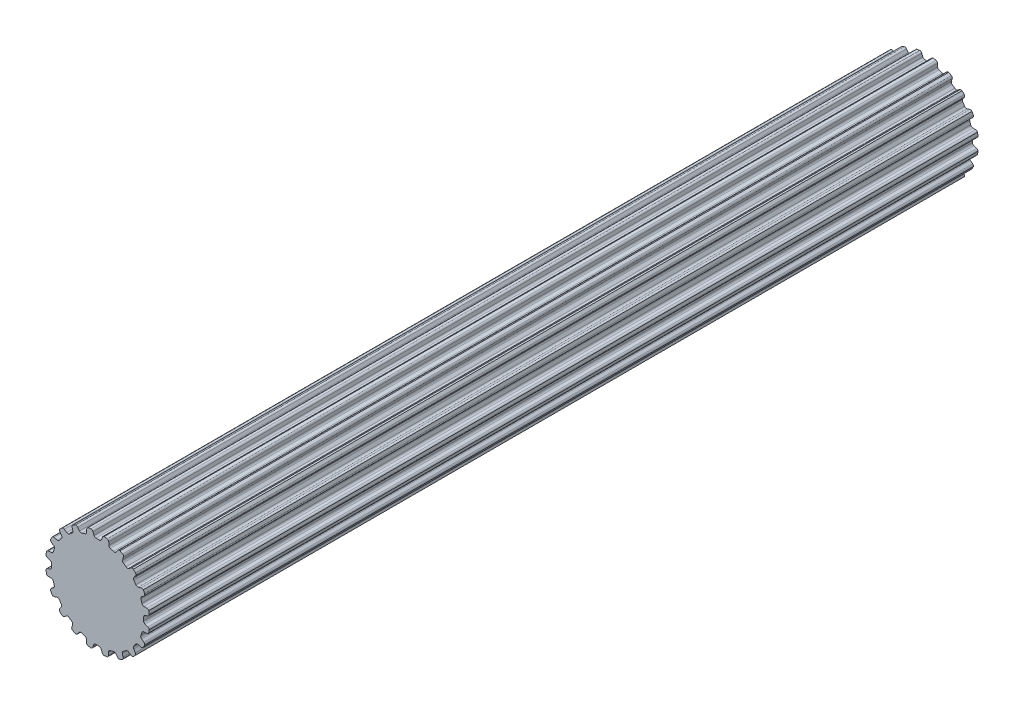
from build123d import *

# Parameters (mm, degrees)
BOSS_EXTRUDE1_DEPTH = 26.70556


with BuildPart() as part:
    # Sketch1 → Boss-Extrude1 (new, symmetric)
    with BuildSketch(Plane.XY):
        with BuildLine():
            Line((-0.106949245, 2.969874934), (0.106949245, 2.969874934))
            ThreePointArc((0.106949245, 2.969874934), (0.196343213, 2.986924176), (0.253739238, 3.057547504))
            Line((0.253739238, 3.057547504), (0.315888147, 3.237526941))
            ThreePointArc((0.315888147, 3.237526941), (0.359032156, 3.298322911), (0.4281449, 3.326269005))
            Line((0.4281449, 3.326269005), (0.620027588, 3.2937547))
            ThreePointArc((0.620027588, 3.2937547), (0.689621142, 3.24802576), (0.718272212, 3.169836791))
            Line((0.718272212, 3.169836791), (0.724389167, 2.979527391))
            ThreePointArc((0.724389167, 2.979527391), (0.750934762, 2.9040661), (0.816027049, 2.857568043))
            Line((0.816027049, 2.857568043), (1.019456602, 2.791469774))
            ThreePointArc((1.019456602, 2.791469774), (1.109743823, 2.780060312), (1.186154496, 2.829490741))
            Line((1.186154496, 2.829490741), (1.300878326, 2.981456288))
            ThreePointArc((1.300878326, 2.981456288), (1.360697704, 3.02594446), (1.435063648, 3.031165762))
            Line((1.435063648, 3.031165762), (1.607507455, 2.940947809))
            ThreePointArc((1.607507455, 2.940947809), (1.659563839, 2.875951412), (1.662650905, 2.792735615))
            Line((1.662650905, 2.792735615), (1.609659636, 2.609850378))
            ThreePointArc((1.609659636, 2.609850378), (1.611587176, 2.529879385), (1.659124931, 2.465542482))
            Line((1.659124931, 2.465542482), (1.832172444, 2.339816104))
            ThreePointArc((1.832172444, 2.339816104), (1.914514976, 2.301064775), (2.002460687, 2.32446371))
            Line((2.002460687, 2.32446371), (2.158529469, 2.433539921))
            ThreePointArc((2.158529469, 2.433539921), (2.229168681, 2.457365482), (2.301508367, 2.439350895))
            Line((2.301508367, 2.439350895), (2.437633293, 2.300260456))
            ThreePointArc((2.437633293, 2.300260456), (2.467056864, 2.222358901), (2.444277744, 2.14226202))
            Line((2.444277744, 2.14226202), (2.337365406, 1.984703026))
            ThreePointArc((2.337365406, 1.984703026), (2.314486209, 1.908050449), (2.339816104, 1.832172444))
            Line((2.339816104, 1.832172444), (2.465542482, 1.659124931))
            ThreePointArc((2.465542482, 1.659124931), (2.531880064, 1.596824985), (2.622752074, 1.591901975))
            Line((2.622752074, 1.591901975), (2.804888709, 1.64741171))
            ThreePointArc((2.804888709, 1.64741171), (2.879433095, 1.648242449), (2.942665411, 1.608755366))
            Line((2.942665411, 1.608755366), (3.0291466, 1.434407582))
            ThreePointArc((3.0291466, 1.434407582), (3.033057175, 1.351226417), (2.986641646, 1.282088892))
            Line((2.986641646, 1.282088892), (2.836273564, 1.165279113))
            ThreePointArc((2.836273564, 1.165279113), (2.790827206, 1.099448241), (2.791469774, 1.019456602))
            Line((2.791469774, 1.019456602), (2.857568043, 0.816027049))
            ThreePointArc((2.857568043, 0.816027049), (2.901407091, 0.736276839), (2.986310214, 0.703513784))
            Line((2.986310214, 0.703513784), (3.1766859, 0.700023363))
            ThreePointArc((3.1766859, 0.700023363), (3.247838536, 0.677777961), (3.295773863, 0.620683653))
            Line((3.295773863, 0.620683653), (3.324145932, 0.4281449))
            ThreePointArc((3.324145932, 0.4281449), (3.302160717, 0.347826477), (3.236652255, 0.29641597))
            Line((3.236652255, 0.29641597), (3.057547504, 0.231789562))
            ThreePointArc((3.057547504, 0.231789562), (2.993982591, 0.183224379), (2.969874934, 0.106949245))
            Line((2.969874934, 0.106949245), (2.969874934, -0.106949245))
            ThreePointArc((2.969874934, -0.106949245), (2.986924176, -0.196343213), (3.057547504, -0.253739238))
            Line((3.057547504, -0.253739238), (3.237526941, -0.315888147))
            ThreePointArc((3.237526941, -0.315888147), (3.298322911, -0.359032156), (3.326269005, -0.4281449))
            Line((3.326269005, -0.4281449), (3.2937547, -0.620027588))
            ThreePointArc((3.2937547, -0.620027588), (3.24802576, -0.689621142), (3.169836791, -0.718272212))
            Line((3.169836791, -0.718272212), (2.979527391, -0.724389167))
            ThreePointArc((2.979527391, -0.724389167), (2.9040661, -0.750934762), (2.857568043, -0.816027049))
            Line((2.857568043, -0.816027049), (2.791469774, -1.019456602))
            ThreePointArc((2.791469774, -1.019456602), (2.780060312, -1.109743823), (2.829490741, -1.186154496))
            Line((2.829490741, -1.186154496), (2.981456288, -1.300878326))
            ThreePointArc((2.981456288, -1.300878326), (3.02594446, -1.360697704), (3.031165762, -1.435063648))
            Line((3.031165762, -1.435063648), (2.940947809, -1.607507455))
            ThreePointArc((2.940947809, -1.607507455), (2.875951412, -1.659563839), (2.792735615, -1.662650905))
            Line((2.792735615, -1.662650905), (2.609850378, -1.609659636))
            ThreePointArc((2.609850378, -1.609659636), (2.529879385, -1.611587176), (2.465542482, -1.659124931))
            Line((2.465542482, -1.659124931), (2.339816104, -1.832172444))
            ThreePointArc((2.339816104, -1.832172444), (2.301064775, -1.914514976), (2.32446371, -2.002460687))
            Line((2.32446371, -2.002460687), (2.433539921, -2.158529469))
            ThreePointArc((2.433539921, -2.158529469), (2.457365482, -2.229168681), (2.439350895, -2.301508367))
            Line((2.439350895, -2.301508367), (2.300260456, -2.437633293))
            ThreePointArc((2.300260456, -2.437633293), (2.222358901, -2.467056864), (2.14226202, -2.444277744))
            Line((2.14226202, -2.444277744), (1.984703026, -2.337365406))
            ThreePointArc((1.984703026, -2.337365406), (1.908050449, -2.314486209), (1.832172444, -2.339816104))
            Line((1.832172444, -2.339816104), (1.659124931, -2.465542482))
            ThreePointArc((1.659124931, -2.465542482), (1.596824985, -2.531880064), (1.591901975, -2.622752074))
            Line((1.591901975, -2.622752074), (1.64741171, -2.804888709))
            ThreePointArc((1.64741171, -2.804888709), (1.648242449, -2.879433095), (1.608755366, -2.942665411))
            Line((1.608755366, -2.942665411), (1.434407582, -3.0291466))
            ThreePointArc((1.434407582, -3.0291466), (1.351226417, -3.033057175), (1.282088892, -2.986641646))
            Line((1.282088892, -2.986641646), (1.165279113, -2.836273564))
            ThreePointArc((1.165279113, -2.836273564), (1.099448241, -2.790827206), (1.019456602, -2.791469774))
            Line((1.019456602, -2.791469774), (0.816027049, -2.857568043))
            ThreePointArc((0.816027049, -2.857568043), (0.736276839, -2.901407091), (0.703513784, -2.986310214))
            Line((0.703513784, -2.986310214), (0.700023363, -3.1766859))
            ThreePointArc((0.700023363, -3.1766859), (0.677777961, -3.247838536), (0.620683653, -3.295773863))
            Line((0.620683653, -3.295773863), (0.4281449, -3.324145932))
            ThreePointArc((0.4281449, -3.324145932), (0.347826477, -3.302160717), (0.29641597, -3.236652255))
            Line((0.29641597, -3.236652255), (0.231789562, -3.057547504))
            ThreePointArc((0.231789562, -3.057547504), (0.183224379, -2.993982591), (0.106949245, -2.969874934))
            Line((0.106949245, -2.969874934), (-0.106949245, -2.969874934))
            ThreePointArc((-0.106949245, -2.969874934), (-0.196343213, -2.986924176), (-0.253739238, -3.057547504))
            Line((-0.253739238, -3.057547504), (-0.315888147, -3.237526941))
            ThreePointArc((-0.315888147, -3.237526941), (-0.359032156, -3.298322911), (-0.4281449, -3.326269005))
            Line((-0.4281449, -3.326269005), (-0.620027588, -3.2937547))
            ThreePointArc((-0.620027588, -3.2937547), (-0.689621142, -3.24802576), (-0.718272212, -3.169836791))
            Line((-0.718272212, -3.169836791), (-0.724389167, -2.979527391))
            ThreePointArc((-0.724389167, -2.979527391), (-0.750934762, -2.9040661), (-0.816027049, -2.857568043))
            Line((-0.816027049, -2.857568043), (-1.019456602, -2.791469774))
            ThreePointArc((-1.019456602, -2.791469774), (-1.109743823, -2.780060312), (-1.186154496, -2.829490741))
            Line((-1.186154496, -2.829490741), (-1.300878326, -2.981456288))
            ThreePointArc((-1.300878326, -2.981456288), (-1.360697704, -3.02594446), (-1.435063648, -3.031165762))
            Line((-1.435063648, -3.031165762), (-1.607507455, -2.940947809))
            ThreePointArc((-1.607507455, -2.940947809), (-1.659563839, -2.875951412), (-1.662650905, -2.792735615))
            Line((-1.662650905, -2.792735615), (-1.609659636, -2.609850378))
            ThreePointArc((-1.609659636, -2.609850378), (-1.611587176, -2.529879385), (-1.659124931, -2.465542482))
            Line((-1.659124931, -2.465542482), (-1.832172444, -2.339816104))
            ThreePointArc((-1.832172444, -2.339816104), (-1.914514976, -2.301064775), (-2.002460687, -2.32446371))
            Line((-2.002460687, -2.32446371), (-2.158529469, -2.433539921))
            ThreePointArc((-2.158529469, -2.433539921), (-2.229168681, -2.457365482), (-2.301508367, -2.439350895))
            Line((-2.301508367, -2.439350895), (-2.437633293, -2.300260456))
            ThreePointArc((-2.437633293, -2.300260456), (-2.467056864, -2.222358901), (-2.444277744, -2.14226202))
            Line((-2.444277744, -2.14226202), (-2.337365406, -1.984703026))
            ThreePointArc((-2.337365406, -1.984703026), (-2.314486209, -1.908050449), (-2.339816104, -1.832172444))
            Line((-2.339816104, -1.832172444), (-2.465542482, -1.659124931))
            ThreePointArc((-2.465542482, -1.659124931), (-2.531880064, -1.596824985), (-2.622752074, -1.591901975))
            Line((-2.622752074, -1.591901975), (-2.804888709, -1.64741171))
            ThreePointArc((-2.804888709, -1.64741171), (-2.879433095, -1.648242449), (-2.942665411, -1.608755366))
            Line((-2.942665411, -1.608755366), (-3.0291466, -1.434407582))
            ThreePointArc((-3.0291466, -1.434407582), (-3.033057175, -1.351226417), (-2.986641646, -1.282088892))
            Line((-2.986641646, -1.282088892), (-2.836273564, -1.165279113))
            ThreePointArc((-2.836273564, -1.165279113), (-2.790827206, -1.099448241), (-2.791469774, -1.019456602))
            Line((-2.791469774, -1.019456602), (-2.857568043, -0.816027049))
            ThreePointArc((-2.857568043, -0.816027049), (-2.901407091, -0.736276839), (-2.986310214, -0.703513784))
            Line((-2.986310214, -0.703513784), (-3.1766859, -0.700023363))
            ThreePointArc((-3.1766859, -0.700023363), (-3.247838536, -0.677777961), (-3.295773863, -0.620683653))
            Line((-3.295773863, -0.620683653), (-3.324145932, -0.4281449))
            ThreePointArc((-3.324145932, -0.4281449), (-3.302160717, -0.347826477), (-3.236652255, -0.29641597))
            Line((-3.236652255, -0.29641597), (-3.057547504, -0.231789562))
            ThreePointArc((-3.057547504, -0.231789562), (-2.993982591, -0.183224379), (-2.969874934, -0.106949245))
            Line((-2.969874934, -0.106949245), (-2.969874934, 0.106949245))
            ThreePointArc((-2.969874934, 0.106949245), (-2.986924176, 0.196343213), (-3.057547504, 0.253739238))
            Line((-3.057547504, 0.253739238), (-3.237526941, 0.315888147))
            ThreePointArc((-3.237526941, 0.315888147), (-3.298322911, 0.359032156), (-3.326269005, 0.4281449))
            Line((-3.326269005, 0.4281449), (-3.2937547, 0.620027588))
            ThreePointArc((-3.2937547, 0.620027588), (-3.24802576, 0.689621142), (-3.169836791, 0.718272212))
            Line((-3.169836791, 0.718272212), (-2.979527391, 0.724389167))
            ThreePointArc((-2.979527391, 0.724389167), (-2.9040661, 0.750934762), (-2.857568043, 0.816027049))
            Line((-2.857568043, 0.816027049), (-2.791469774, 1.019456602))
            ThreePointArc((-2.791469774, 1.019456602), (-2.780060312, 1.109743823), (-2.829490741, 1.186154496))
            Line((-2.829490741, 1.186154496), (-2.981456288, 1.300878326))
            ThreePointArc((-2.981456288, 1.300878326), (-3.02594446, 1.360697704), (-3.031165762, 1.435063648))
            Line((-3.031165762, 1.435063648), (-2.940947809, 1.607507455))
            ThreePointArc((-2.940947809, 1.607507455), (-2.875951412, 1.659563839), (-2.792735615, 1.662650905))
            Line((-2.792735615, 1.662650905), (-2.609850378, 1.609659636))
            ThreePointArc((-2.609850378, 1.609659636), (-2.529879385, 1.611587176), (-2.465542482, 1.659124931))
            Line((-2.465542482, 1.659124931), (-2.339816104, 1.832172444))
            ThreePointArc((-2.339816104, 1.832172444), (-2.301064775, 1.914514976), (-2.32446371, 2.002460687))
            Line((-2.32446371, 2.002460687), (-2.433539921, 2.158529469))
            ThreePointArc((-2.433539921, 2.158529469), (-2.457365482, 2.229168681), (-2.439350895, 2.301508367))
            Line((-2.439350895, 2.301508367), (-2.300260456, 2.437633293))
            ThreePointArc((-2.300260456, 2.437633293), (-2.222358901, 2.467056864), (-2.14226202, 2.444277744))
            Line((-2.14226202, 2.444277744), (-1.984703026, 2.337365406))
            ThreePointArc((-1.984703026, 2.337365406), (-1.908050449, 2.314486209), (-1.832172444, 2.339816104))
            Line((-1.832172444, 2.339816104), (-1.659124931, 2.465542482))
            ThreePointArc((-1.659124931, 2.465542482), (-1.596824985, 2.531880064), (-1.591901975, 2.622752074))
            Line((-1.591901975, 2.622752074), (-1.64741171, 2.804888709))
            ThreePointArc((-1.64741171, 2.804888709), (-1.648242449, 2.879433095), (-1.608755366, 2.942665411))
            Line((-1.608755366, 2.942665411), (-1.434407582, 3.0291466))
            ThreePointArc((-1.434407582, 3.0291466), (-1.351226417, 3.033057175), (-1.282088892, 2.986641646))
            Line((-1.282088892, 2.986641646), (-1.165279113, 2.836273564))
            ThreePointArc((-1.165279113, 2.836273564), (-1.099448241, 2.790827206), (-1.019456602, 2.791469774))
            Line((-1.019456602, 2.791469774), (-0.816027049, 2.857568043))
            ThreePointArc((-0.816027049, 2.857568043), (-0.736276839, 2.901407091), (-0.703513784, 2.986310214))
            Line((-0.703513784, 2.986310214), (-0.700023363, 3.1766859))
            ThreePointArc((-0.700023363, 3.1766859), (-0.677777961, 3.247838536), (-0.620683653, 3.295773863))
            Line((-0.620683653, 3.295773863), (-0.4281449, 3.324145932))
            ThreePointArc((-0.4281449, 3.324145932), (-0.347826477, 3.302160717), (-0.29641597, 3.236652255))
            Line((-0.29641597, 3.236652255), (-0.231789562, 3.057547504))
            ThreePointArc((-0.231789562, 3.057547504), (-0.183224379, 2.993982591), (-0.106949245, 2.969874934))
        make_face()
    extrude(amount=BOSS_EXTRUDE1_DEPTH, both=True)


solid = part.part
